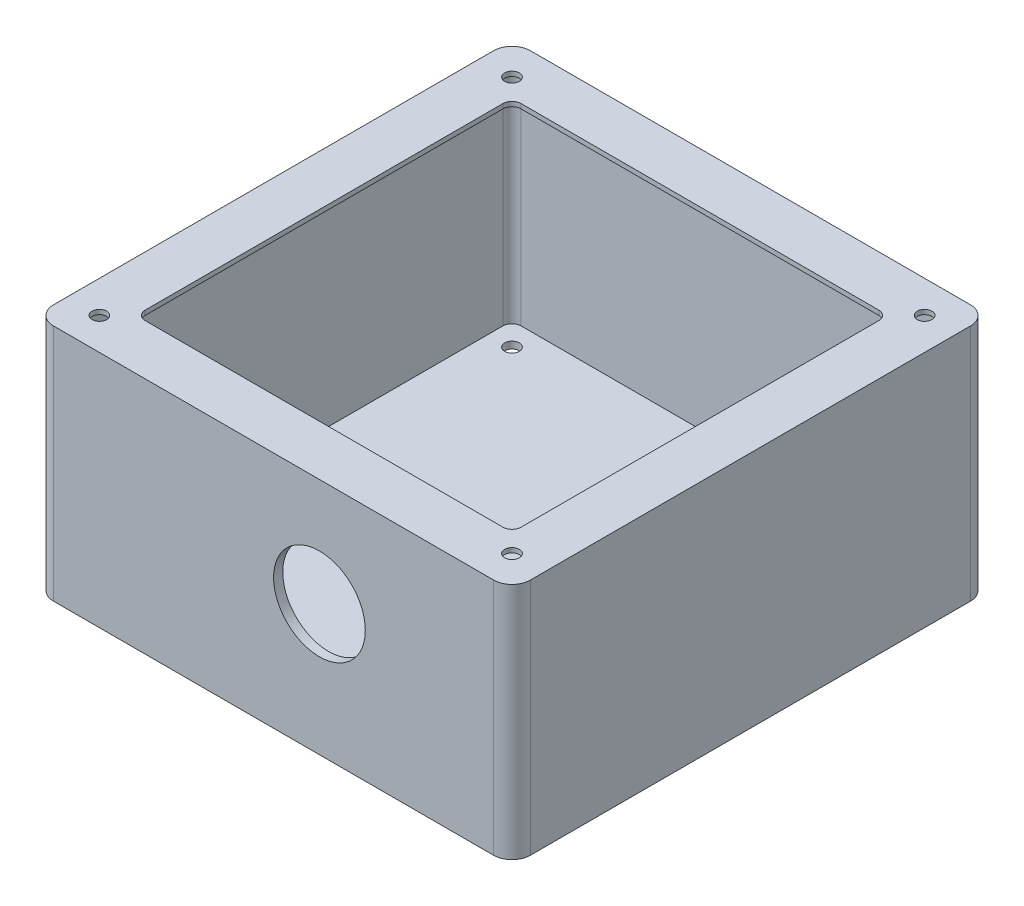
from build123d import *

# Parameters (mm, degrees)
SKETCH1_R            = 1.6
BOSS_EXTRUDE1_DEPTH  = 1.5
BOSS_EXTRUDE10_DEPTH = 50
SKETCH5_R            = 10
CUT_EXTRUDE1_DEPTH   = 10
SKETCH6_R            = 1.6
BOSS_EXTRUDE11_DEPTH = 1
BOSS_EXTRUDE12_START = -1
BOSS_EXTRUDE12_DEPTH = 1


with BuildPart() as part:
    # Sketch1 → Boss-Extrude1 (new body)
    with BuildSketch(Plane(origin=(0, 0, 0), x_dir=(1, 0, 0), z_dir=(0, 1, 0))):
        with BuildLine():
            Line((48, -50), (-48, -50))
            ThreePointArc((-48, -50), (-49.414213562, -49.414213562), (-50, -48))
            Line((-50, -48), (-50, 48))
            ThreePointArc((-50, 48), (-49.414213562, 49.414213562), (-48, 50))
            Line((-48, 50), (48, 50))
            ThreePointArc((48, 50), (49.414213562, 49.414213562), (50, 48))
            Line((50, 48), (50, -48))
            ThreePointArc((50, -48), (49.414213562, -49.414213562), (48, -50))
        make_face()
        with Locations((-45, 45)):
            Circle(SKETCH1_R, mode=Mode.SUBTRACT)
        with Locations((45, 45)):
            Circle(SKETCH1_R, mode=Mode.SUBTRACT)
        with Locations((45, -45)):
            Circle(SKETCH1_R, mode=Mode.SUBTRACT)
        with Locations((-45, -45)):
            Circle(SKETCH1_R, mode=Mode.SUBTRACT)
    extrude(amount=BOSS_EXTRUDE1_DEPTH)



with BuildPart() as body_2:
    # Sketch2 → Boss-Extrude10 (new body)
    with BuildSketch(Plane(origin=(0, 1.5, 0), x_dir=(1, 0, 0), z_dir=(0, 1, 0))):
        with BuildLine():
            Line((48, 52), (-48, 52))
            ThreePointArc((-48, 52), (-50.828427125, 50.828427125), (-52, 48))
            Line((-52, 48), (-52, -48))
            ThreePointArc((-52, -48), (-50.828427125, -50.828427125), (-48, -52))
            Line((-48, -52), (48, -52))
            ThreePointArc((48, -52), (50.828427125, -50.828427125), (52, -48))
            Line((52, -48), (52, 48))
            ThreePointArc((52, 48), (50.828427125, 50.828427125), (48, 52))
        make_face()
        with BuildLine():
            Line((48, 50), (-48, 50))
            ThreePointArc((-48, 50), (-49.414213562, 49.414213562), (-50, 48))
            Line((-50, 48), (-50, -48))
            ThreePointArc((-50, -48), (-49.414213562, -49.414213562), (-48, -50))
            Line((-48, -50), (48, -50))
            ThreePointArc((48, -50), (49.414213562, -49.414213562), (50, -48))
            Line((50, -48), (50, 48))
            ThreePointArc((50, 48), (49.414213562, 49.414213562), (48, 50))
        make_face(mode=Mode.SUBTRACT)
    extrude(amount=BOSS_EXTRUDE10_DEPTH)

    # Sketch5 → Cut-Extrude1 (cut)
    with BuildSketch(Plane.XY.offset(52)):
        with Locations((10, 29)):
            Circle(SKETCH5_R)
    extrude(amount=-CUT_EXTRUDE1_DEPTH, mode=Mode.SUBTRACT)

    # Sketch6 → Boss-Extrude11 (add)
    with BuildSketch(Plane(origin=(0, 51.5, 0), x_dir=(1, 0, 0), z_dir=(0, 1, 0))):
        with BuildLine():
            Line((48, 52), (-48, 52))
            ThreePointArc((-48, 52), (-50.828427125, 50.828427125), (-52, 48))
            Line((-52, 48), (-52, -48))
            ThreePointArc((-52, -48), (-50.828427125, -50.828427125), (-48, -52))
            Line((-48, -52), (48, -52))
            ThreePointArc((48, -52), (50.828427125, -50.828427125), (52, -48))
            Line((52, -48), (52, 48))
            ThreePointArc((52, 48), (50.828427125, 50.828427125), (48, 52))
        make_face()
        with Locations((-45, 45)):
            Circle(SKETCH6_R, mode=Mode.SUBTRACT)
        with Locations((45, 45)):
            Circle(SKETCH6_R, mode=Mode.SUBTRACT)
        with Locations((45, -45)):
            Circle(SKETCH6_R, mode=Mode.SUBTRACT)
        with Locations((-45, -45)):
            Circle(SKETCH6_R, mode=Mode.SUBTRACT)
        with BuildLine():
            Line((-39, -41), (39, -41))
            ThreePointArc((39, -41), (40.414213562, -40.414213562), (41, -39))
            Line((41, -39), (41, 39))
            ThreePointArc((41, 39), (40.414213562, 40.414213562), (39, 41))
            Line((39, 41), (-39, 41))
            ThreePointArc((-39, 41), (-40.414213562, 40.414213562), (-41, 39))
            Line((-41, 39), (-41, -39))
            ThreePointArc((-41, -39), (-40.414213562, -40.414213562), (-39, -41))
        make_face(mode=Mode.SUBTRACT)
    extrude(amount=BOSS_EXTRUDE11_DEPTH)


with BuildPart() as part_1:
    add(part.part)

    add(body_2.part)  # Boss-Extrude12 merges body 2
    # Sketch2<6> → Boss-Extrude12 (add)
    with BuildSketch(Plane(origin=(0, 1.5, 0), x_dir=(1, 0, 0), z_dir=(0, 1, 0)).offset(BOSS_EXTRUDE12_START)):
        with BuildLine():
            Line((48, 52), (-48, 52))
            ThreePointArc((-48, 52), (-50.828427125, 50.828427125), (-52, 48))
            Line((-52, 48), (-52, -48))
            ThreePointArc((-52, -48), (-50.828427125, -50.828427125), (-48, -52))
            Line((-48, -52), (48, -52))
            ThreePointArc((48, -52), (50.828427125, -50.828427125), (52, -48))
            Line((52, -48), (52, 48))
            ThreePointArc((52, 48), (50.828427125, 50.828427125), (48, 52))
        make_face()
        with BuildLine():
            Line((48, 50), (-48, 50))
            ThreePointArc((-48, 50), (-49.414213562, 49.414213562), (-50, 48))
            Line((-50, 48), (-50, -48))
            ThreePointArc((-50, -48), (-49.414213562, -49.414213562), (-48, -50))
            Line((-48, -50), (48, -50))
            ThreePointArc((48, -50), (49.414213562, -49.414213562), (50, -48))
            Line((50, -48), (50, 48))
            ThreePointArc((50, 48), (49.414213562, 49.414213562), (48, 50))
        make_face(mode=Mode.SUBTRACT)
    extrude(amount=BOSS_EXTRUDE12_DEPTH)


solid = part_1.part
